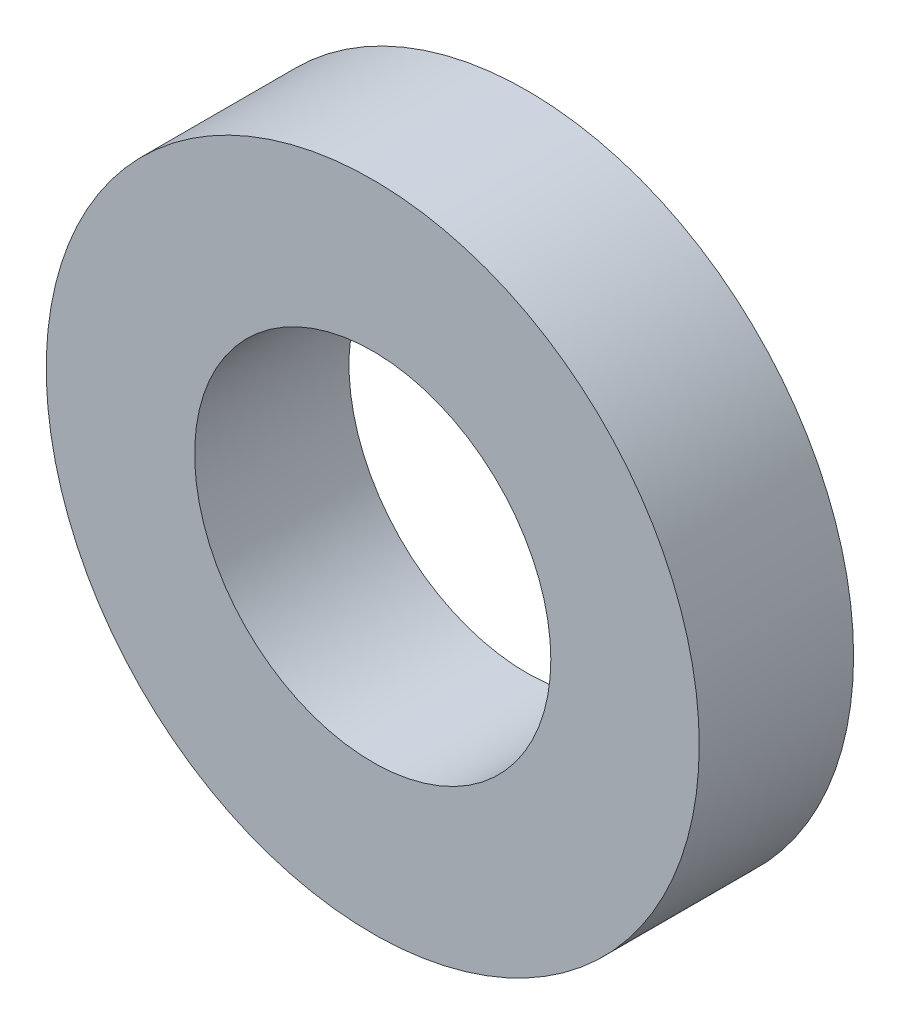
from build123d import *

# Parameters (mm, degrees)
SKETCH1_R           = 27.5
SKETCH1_R_2         = 15
BOSS_EXTRUDE1_DEPTH = 13


with BuildPart() as part:
    # Sketch1 → Boss-Extrude1 (new body)
    with BuildSketch(Plane.XY):
        Circle(SKETCH1_R)
        Circle(SKETCH1_R_2, mode=Mode.SUBTRACT)
    extrude(amount=-BOSS_EXTRUDE1_DEPTH)


solid = part.part
